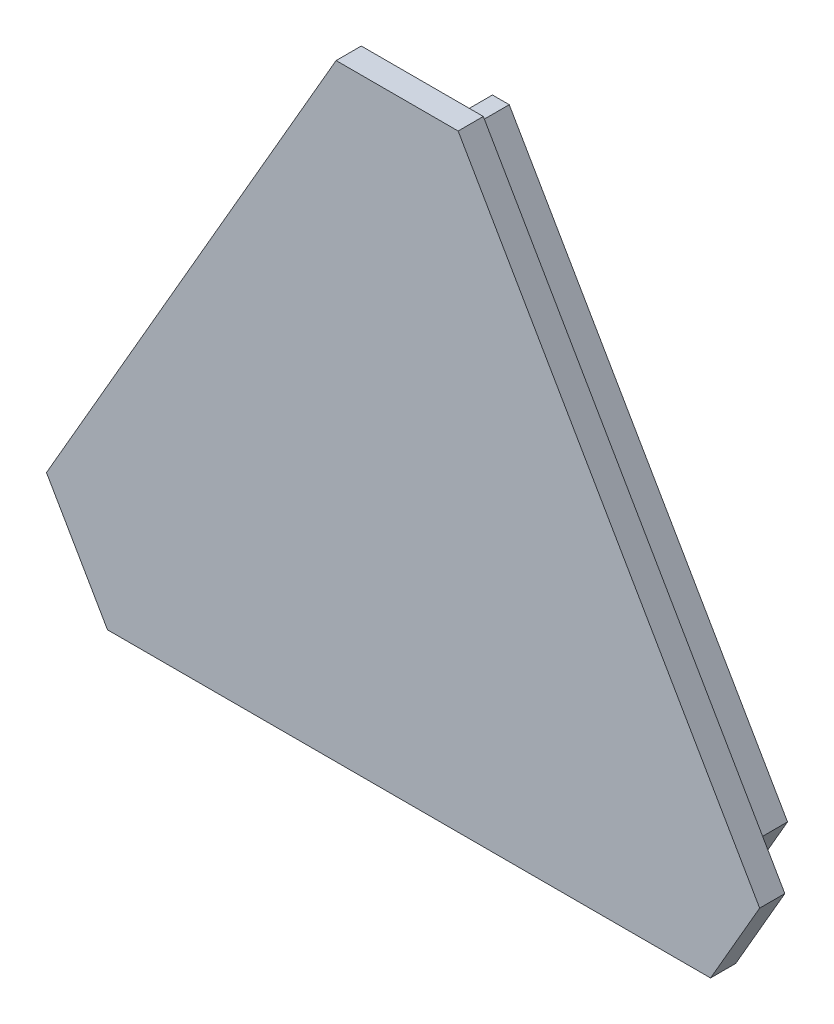
from build123d import *

# Parameters (mm, degrees)
BOSS_EXTRUDE1_DEPTH = 10
BOSS_EXTRUDE2_DEPTH = 5


with BuildPart() as part:
    # Sketch2 → Boss-Extrude1 (new body)
    with BuildSketch(Plane.XY.offset(297.14777646)):
        Polygon((222.115957416, -44.106514518), (277.385017308, -139.835334338), (270.115957416, -152.425715395), (159.577837631, -152.425715395), (157.90907535, -149.535334338), (159.127064415, -147.425715395), (267.22920607, -147.425715395), (271.611514616, -139.835334338), (217.560443789, -46.216133462), (218.778432853, -44.106514518), align=None)
    extrude(amount=-BOSS_EXTRUDE1_DEPTH)

    # Sketch3 → Boss-Extrude2 (add)
    with BuildSketch(Plane.XY.offset(297.14777646)):
        Polygon((202.72809537, -38.706514518), (226.965699677, -38.706514518), (286.851062648, -142.431005814), (277.096897524, -159.325715395), (157.326171581, -159.325715395), (145.207369428, -138.335334338), align=None)
    extrude(amount=BOSS_EXTRUDE2_DEPTH)


with BuildPart() as body_2:
    # Mirror1: mirrored copy
    add(part.part.mirror(Plane(origin=(218.778432853, -44.106514518, 287.14777646), x_dir=(1, 0, 0), z_dir=(0, 0, 1))))


with BuildPart() as body_2_2:
    # Mirror2: mirrored copy
    add(body_2.part.mirror(Plane(origin=(218.778432853, -44.106514518, 287.14777646), x_dir=(1, 0, 0), z_dir=(0, 0, -1))))


solid = body_2_2.part
